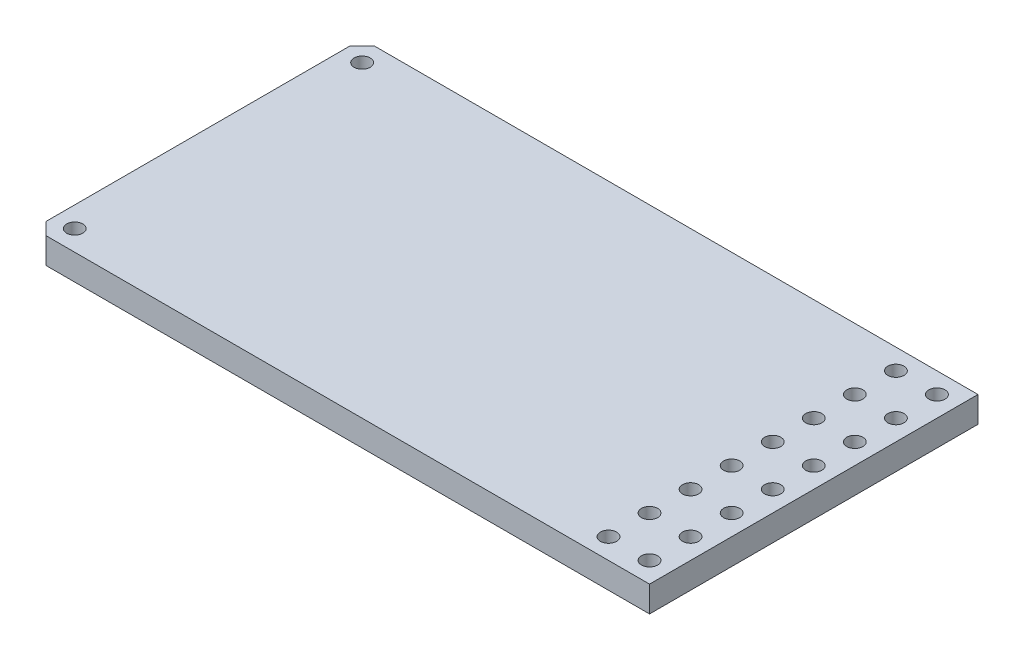
from build123d import *

# Parameters (mm, degrees)
SKETCH1_R           = 0.5
BOSS_EXTRUDE1_DEPTH = 0.8


with BuildPart() as part:
    # Sketch1 → Boss-Extrude1 (new, symmetric)
    with BuildSketch(Plane(origin=(0, 0, 0), x_dir=(1, 0, 0), z_dir=(0, 1, 0))):
        Polygon((-19.05, -9.398), (-18.288, -10.16), (19.05, -10.16), (19.05, 10.16), (-18.288, 10.16), (-19.05, 9.398), align=None)
        with Locations(Location((-17.78, -8.89, 0), (0, 0, 270))):
            Circle(SKETCH1_R, mode=Mode.SUBTRACT)
        with Locations(Location((15.24, -8.89, 0), (0, 0, 270))):
            Circle(SKETCH1_R, mode=Mode.SUBTRACT)
        with Locations(Location((17.78, -8.89, 0), (0, 0, 270))):
            Circle(SKETCH1_R, mode=Mode.SUBTRACT)
        with Locations(Location((15.24, -6.35, 0), (0, 0, 270))):
            Circle(SKETCH1_R, mode=Mode.SUBTRACT)
        with Locations(Location((17.78, -6.35, 0), (0, 0, 270))):
            Circle(SKETCH1_R, mode=Mode.SUBTRACT)
        with Locations(Location((15.24, -3.81, 0), (0, 0, 270))):
            Circle(SKETCH1_R, mode=Mode.SUBTRACT)
        with Locations(Location((17.78, -3.81, 0), (0, 0, 270))):
            Circle(SKETCH1_R, mode=Mode.SUBTRACT)
        with Locations(Location((15.24, -1.27, 0), (0, 0, 270))):
            Circle(SKETCH1_R, mode=Mode.SUBTRACT)
        with Locations(Location((17.78, -1.27, 0), (0, 0, 270))):
            Circle(SKETCH1_R, mode=Mode.SUBTRACT)
        with Locations(Location((-17.78, 8.89, 0), (0, 0, 270))):
            Circle(SKETCH1_R, mode=Mode.SUBTRACT)
        with Locations(Location((15.24, 1.27, 0), (0, 0, 270))):
            Circle(SKETCH1_R, mode=Mode.SUBTRACT)
        with Locations(Location((17.78, 1.27, 0), (0, 0, 270))):
            Circle(SKETCH1_R, mode=Mode.SUBTRACT)
        with Locations(Location((15.24, 3.81, 0), (0, 0, 270))):
            Circle(SKETCH1_R, mode=Mode.SUBTRACT)
        with Locations(Location((17.78, 3.81, 0), (0, 0, 270))):
            Circle(SKETCH1_R, mode=Mode.SUBTRACT)
        with Locations(Location((15.24, 6.35, 0), (0, 0, 270))):
            Circle(SKETCH1_R, mode=Mode.SUBTRACT)
        with Locations(Location((17.78, 6.35, 0), (0, 0, 270))):
            Circle(SKETCH1_R, mode=Mode.SUBTRACT)
        with Locations(Location((15.24, 8.89, 0), (0, 0, 270))):
            Circle(SKETCH1_R, mode=Mode.SUBTRACT)
        with Locations(Location((17.78, 8.89, 0), (0, 0, 270))):
            Circle(SKETCH1_R, mode=Mode.SUBTRACT)
    extrude(amount=BOSS_EXTRUDE1_DEPTH, both=True)


solid = part.part
